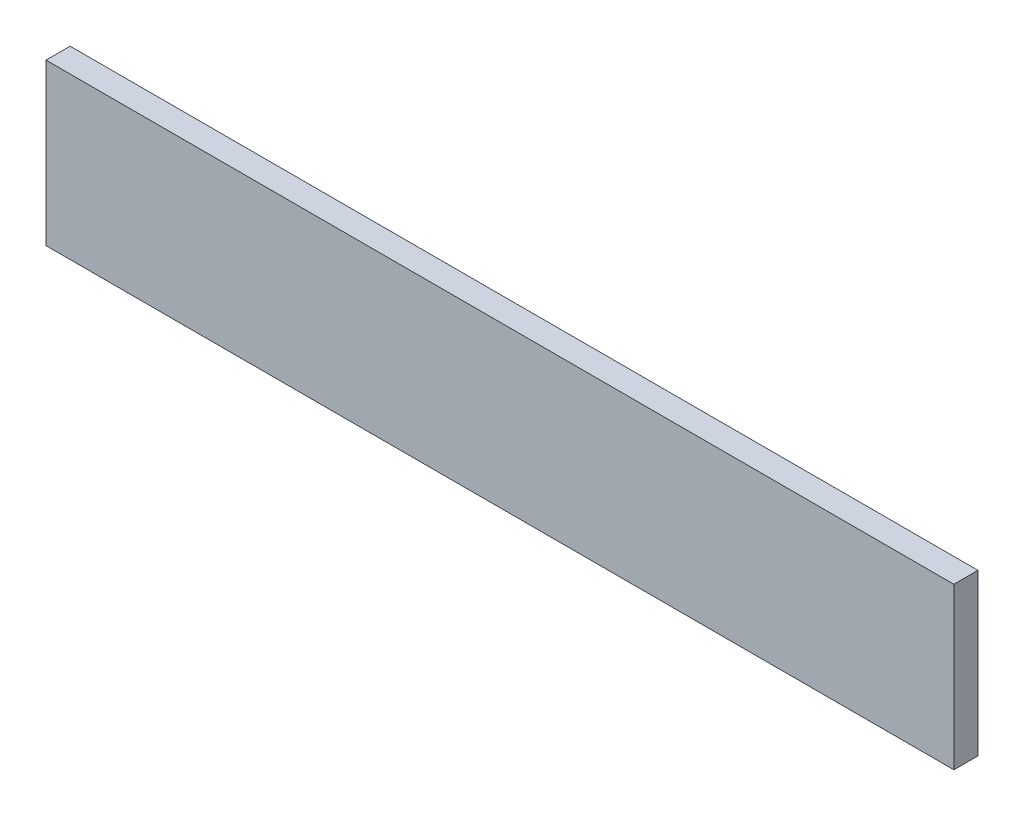
from build123d import *

# Parameters (mm, degrees)
SKETCH1_W           = 717.55
SKETCH1_H           = 127
BOSS_EXTRUDE1_DEPTH = 19.05


with BuildPart() as part:
    # Sketch1 → Boss-Extrude1 (new body)
    with BuildSketch(Plane.XY):
        with Locations((358.775, 63.5)):
            Rectangle(SKETCH1_W, SKETCH1_H)
    extrude(amount=BOSS_EXTRUDE1_DEPTH)


solid = part.part
